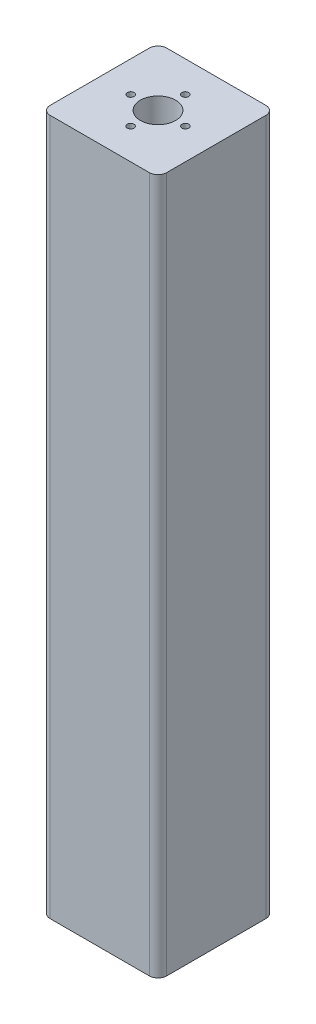
from build123d import *

# Parameters (mm, degrees)
SKETCH1_W           = 34.036
SKETCH1_H           = 34.036
BOSS_EXTRUDE1_DEPTH = 203.2
SKETCH2_R           = 1
CUT_EXTRUDE1_DEPTH  = 38.1
FILLET1_R           = 2.54
SKETCH3_R           = 5.15
CUT_EXTRUDE2_DEPTH  = 190.5
SKETCH4_R           = 1.5875
CUT_EXTRUDE3_DEPTH  = 205.620293832


with BuildPart() as part:
    # Sketch1 → Boss-Extrude1 (new body)
    with BuildSketch(Plane(origin=(0, 0, 0), x_dir=(1, 0, 0), z_dir=(0, 1, 0))):
        Rectangle(SKETCH1_W, SKETCH1_H)
    extrude(amount=BOSS_EXTRUDE1_DEPTH)

    # Sketch2 → Cut-Extrude1 (cut)
    with BuildSketch(Plane(origin=(0, 203.2, 0), x_dir=(1, 0, 0), z_dir=(0, 1, 0))):
        with Locations(Location((0, 8, 0), (0, 0, 270))):
            Circle(SKETCH2_R)
        with Locations(Location((0, -8, 0), (0, 0, 270))):
            Circle(SKETCH2_R)
        with Locations(Location((-8, 0, 0), (0, 0, 270))):
            Circle(SKETCH2_R)
        with Locations(Location((8, 0, 0), (0, 0, 270))):
            Circle(SKETCH2_R)
    extrude(amount=-CUT_EXTRUDE1_DEPTH, mode=Mode.SUBTRACT)

    # Fillet1
    fillet1_edges = [part.edges().sort_by_distance(p)[0] for p in [
        (-17.018, 101.6, -17.018),
        (17.018, 101.6, -17.018),
        (17.018, 101.6, 17.018),
        (-17.018, 101.6, 17.018),
    ]]
    fillet(fillet1_edges, radius=FILLET1_R)

    # Sketch3 → Cut-Extrude2 (cut)
    with BuildSketch(Plane(origin=(0, 203.2, 0), x_dir=(1, 0, 0), z_dir=(0, 1, 0))):
        with Locations(Location((0, 0, 0), (0, 0, 270))):
            Circle(SKETCH3_R)
    extrude(amount=-CUT_EXTRUDE2_DEPTH, mode=Mode.SUBTRACT)

    # Sketch4 → Cut-Extrude3 (cut, through all)
    with BuildSketch(Plane.XZ):
        with Locations(Location((0, 0, 0), (0, 0, 270))):
            Circle(SKETCH4_R)
    extrude(amount=-CUT_EXTRUDE3_DEPTH, mode=Mode.SUBTRACT)


solid = part.part
